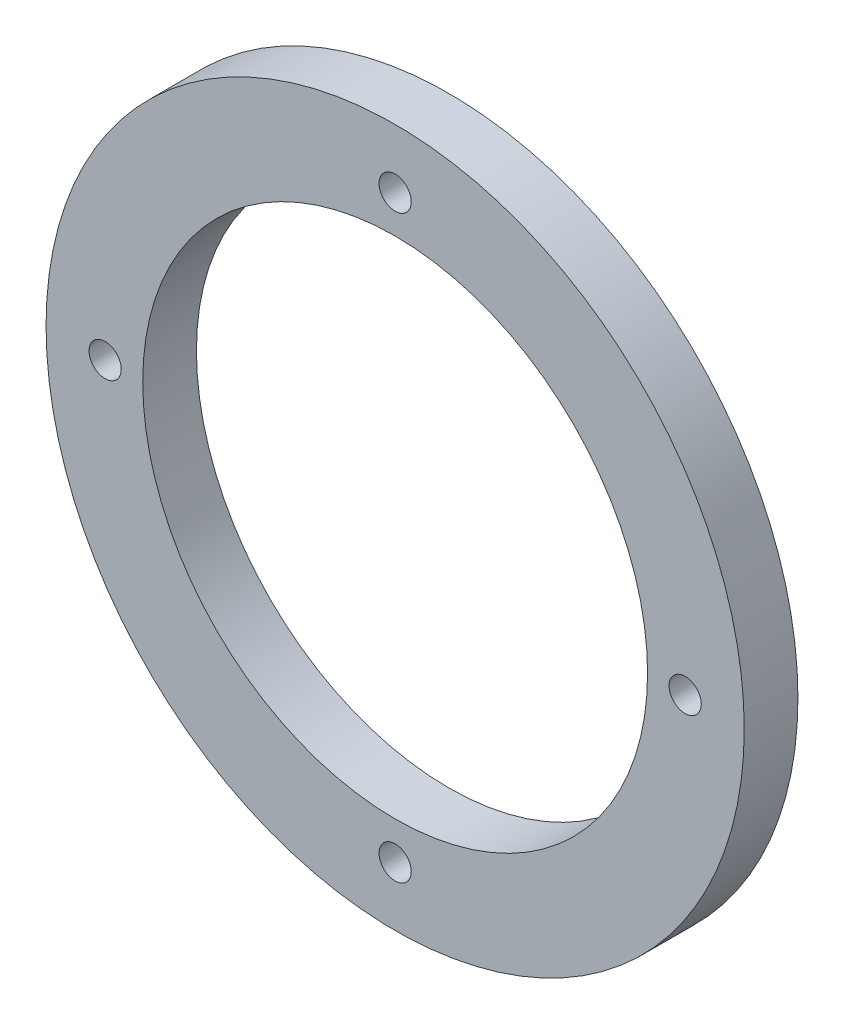
from build123d import *

# Parameters (mm, degrees)
SKETCH1_R           = 32.5
SKETCH1_R_2         = 23.5
SKETCH1_R_3         = 1.5
BOSS_EXTRUDE1_DEPTH = 5


with BuildPart() as part:
    # Sketch1 → Boss-Extrude1 (new body)
    with BuildSketch(Plane.XY):
        Circle(SKETCH1_R)
        Circle(SKETCH1_R_2, mode=Mode.SUBTRACT)
        with Locations((-27, 0)):
            Circle(SKETCH1_R_3, mode=Mode.SUBTRACT)
        with Locations((27, 0)):
            Circle(SKETCH1_R_3, mode=Mode.SUBTRACT)
        with Locations((0, 27)):
            Circle(SKETCH1_R_3, mode=Mode.SUBTRACT)
        with Locations((0, -27)):
            Circle(SKETCH1_R_3, mode=Mode.SUBTRACT)
    extrude(amount=BOSS_EXTRUDE1_DEPTH)


solid = part.part
